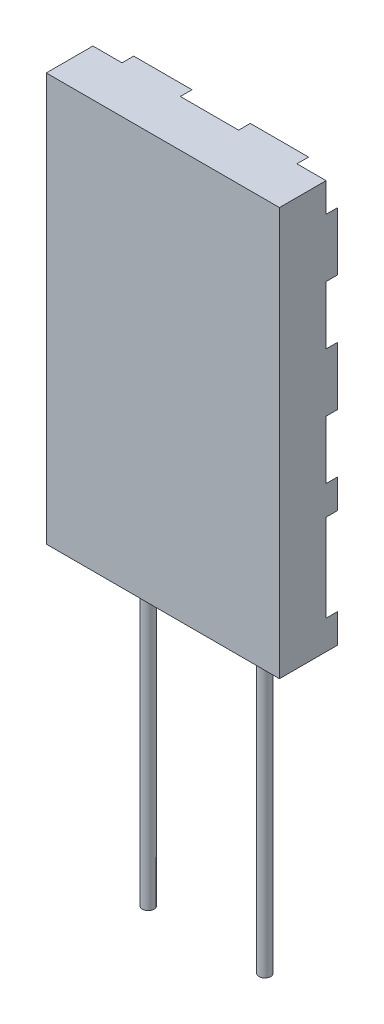
from build123d import *

# Parameters (mm, degrees)
SKETCH_1_W          = 4
SKETCH_1_H          = 7
EXTRUDE_2_DEPTH     = 1
CUT_EXTRUDE_1_DEPTH = 0.2
CUT_EXTRUDE_3_DEPTH = 0.2
SWEEP_1_PROFILE_R   = 0.1
SWEEP_2_PROFILE_R   = 0.1


with BuildPart() as part:
    # 草图1 → 凸台-拉伸2 (new body)
    with BuildSketch(Plane.XY):
        Rectangle(SKETCH_1_W, SKETCH_1_H)
    extrude(amount=EXTRUDE_2_DEPTH)

    # 草图2 → 切除-拉伸1 (cut)
    with BuildSketch(Plane(origin=(0, 0, 0), x_dir=(-1, 0, 0), z_dir=(0, 0, -1))):
        Polygon((1, -3.5), (2, -2.5), (2, -1.5), (0, -3.5), align=None)
        Polygon((-1, -3.5), (2, -0.5), (2, 0.5), (-2, -3.5), align=None)
        Polygon((-2, -2.5), (2, 1.5), (2, 2.5), (-2, -1.5), align=None)
        Polygon((2, 4), (-2, 0), (-2, -0.5), (2, 3.5), align=None)
        Polygon((-2, 1), (0.5, 3.5), (-0.5, 3.5), (-2, 2), align=None)
        Polygon((-2, 3), (-1.5, 3.5), (-2, 3.5), align=None)
    extrude(amount=-CUT_EXTRUDE_1_DEPTH, mode=Mode.SUBTRACT)

    # 草图4 → 切除-拉伸3 (cut)
    with BuildSketch(Plane.XY):
        Polygon((1, -4), (2, -3), (2, -2), (0, -4), align=None)
        Polygon((-1, -4), (2, -1), (2, 0), (-2, -4), align=None)
        Polygon((-2, -3), (2, 1), (2, 2), (-2, -2), align=None)
        Polygon((2, 4), (-2, 0), (-2, -1), (2, 3), align=None)
        Polygon((-2, 1), (1, 4), (0, 4), (-2, 2), align=None)
        Polygon((-2, 3), (-1, 4), (-2, 4), align=None)
    extrude(amount=CUT_EXTRUDE_3_DEPTH, mode=Mode.SUBTRACT)

    # 扫描1: sweep along a path in 草图5
    with BuildLine(Plane.XY.offset(0.5)) as sweep_1_path:
        Line((1.25, -3.5), (1.25, -8.5))
    # 扫描1 profile (on start of the path) → 扫描1 (sweep)
    with BuildSketch(Plane(origin=(1.25, -3.5, 0.5), x_dir=(-1, 0, 0), z_dir=(0, -1, 0))):
        Circle(SWEEP_1_PROFILE_R)
    sweep(path=sweep_1_path.line)

    # 扫描2: sweep along a path in 草图18
    with BuildLine(Plane.XY.offset(0.5)) as sweep_2_path:
        Line((-0.75, -3.5), (-0.75, -8.5))
    # 扫描2 profile (on start of the path) → 扫描2 (sweep)
    with BuildSketch(Plane(origin=(-0.75, -3.5, 0.5), x_dir=(-1, 0, 0), z_dir=(0, -1, 0))):
        Circle(SWEEP_2_PROFILE_R)
    sweep(path=sweep_2_path.line)


solid = part.part
